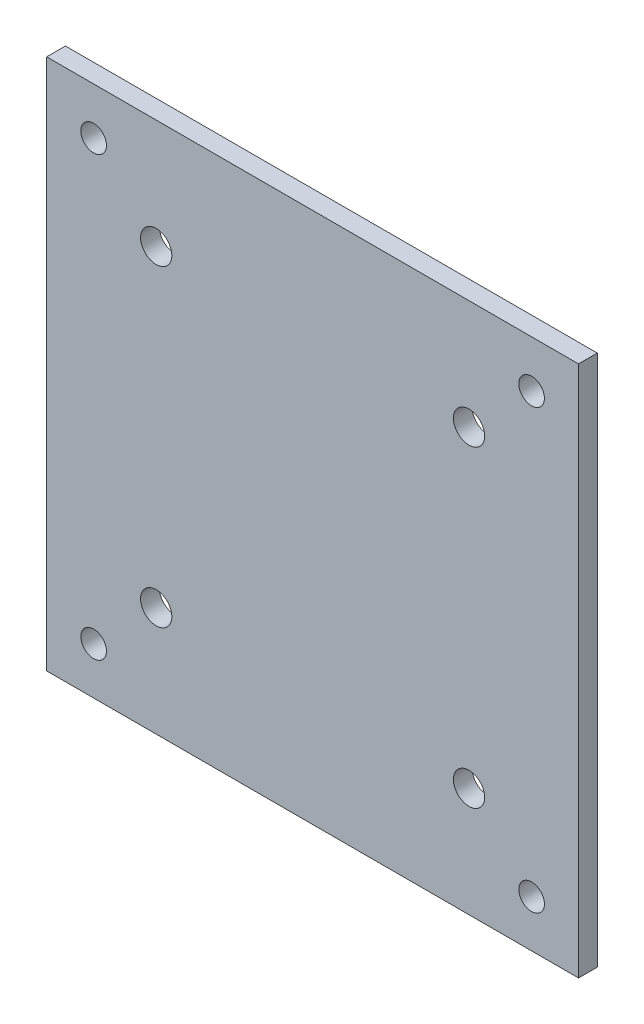
from build123d import *

# Parameters (mm, degrees)
SKETCH1_W           = 65
SKETCH1_H           = 65
SKETCH1_R           = 2.55
BOSS_EXTRUDE1_DEPTH = 3
SKETCH2_W           = 85
SKETCH2_H           = 85
SKETCH2_R           = 2.05
SKETCH2_R_2         = 2.5
BOSS_EXTRUDE2_DEPTH = 3


with BuildPart() as part:
    # Sketch1 → Boss-Extrude1 (new body)
    with BuildSketch(Plane.XY):
        Rectangle(SKETCH1_W, SKETCH1_H)
        with Locations((-25, 25)):
            Circle(SKETCH1_R, mode=Mode.SUBTRACT)
        with Locations((25, 25)):
            Circle(SKETCH1_R, mode=Mode.SUBTRACT)
        with Locations((-25, -25)):
            Circle(SKETCH1_R, mode=Mode.SUBTRACT)
        with Locations((25, -25)):
            Circle(SKETCH1_R, mode=Mode.SUBTRACT)
    extrude(amount=BOSS_EXTRUDE1_DEPTH)

    # Sketch2 → Boss-Extrude2 (add)
    with BuildSketch(Plane.XY.offset(3)):
        Rectangle(SKETCH2_W, SKETCH2_H)
        with Locations((-35, 35)):
            Circle(SKETCH2_R, mode=Mode.SUBTRACT)
        with Locations(Location((35, 35, 0), (0, 0, 180))):
            Circle(SKETCH2_R, mode=Mode.SUBTRACT)
        with Locations((35, -35)):
            Circle(SKETCH2_R, mode=Mode.SUBTRACT)
        with Locations(Location((-35, -35, 0), (0, 0, 180))):
            Circle(SKETCH2_R, mode=Mode.SUBTRACT)
        with Locations((-25, 25)):
            Circle(SKETCH2_R_2, mode=Mode.SUBTRACT)
        with Locations((25, 25)):
            Circle(SKETCH2_R_2, mode=Mode.SUBTRACT)
        with Locations((25, -25)):
            Circle(SKETCH2_R_2, mode=Mode.SUBTRACT)
        with Locations((-25, -25)):
            Circle(SKETCH2_R_2, mode=Mode.SUBTRACT)
    extrude(amount=-BOSS_EXTRUDE2_DEPTH)


solid = part.part
